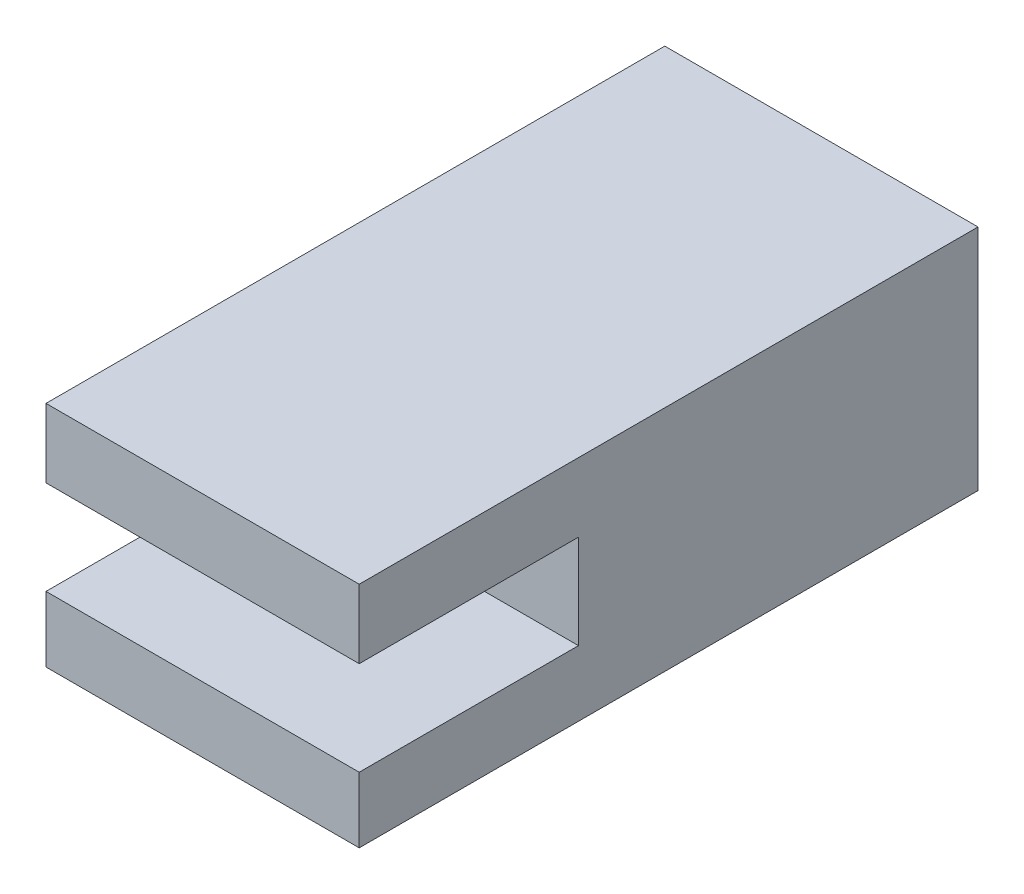
from build123d import *

# Parameters (mm, degrees)
EXTRUDE_1_DEPTH = 10


with BuildPart() as part:
    # 草图1 → 凸台-拉伸1 (new body)
    with BuildSketch(Plane(origin=(0, 0, 0), x_dir=(0, 0, -1), z_dir=(1, 0, 0))):
        Polygon((0, 2.092198582), (0, 0), (19.7563346, 0), (19.7563346, 7.290780142), (0, 7.290780142), (0, 5.092198582), (7, 5.092198582), (7, 2.092198582), align=None)
    extrude(amount=EXTRUDE_1_DEPTH)


solid = part.part
